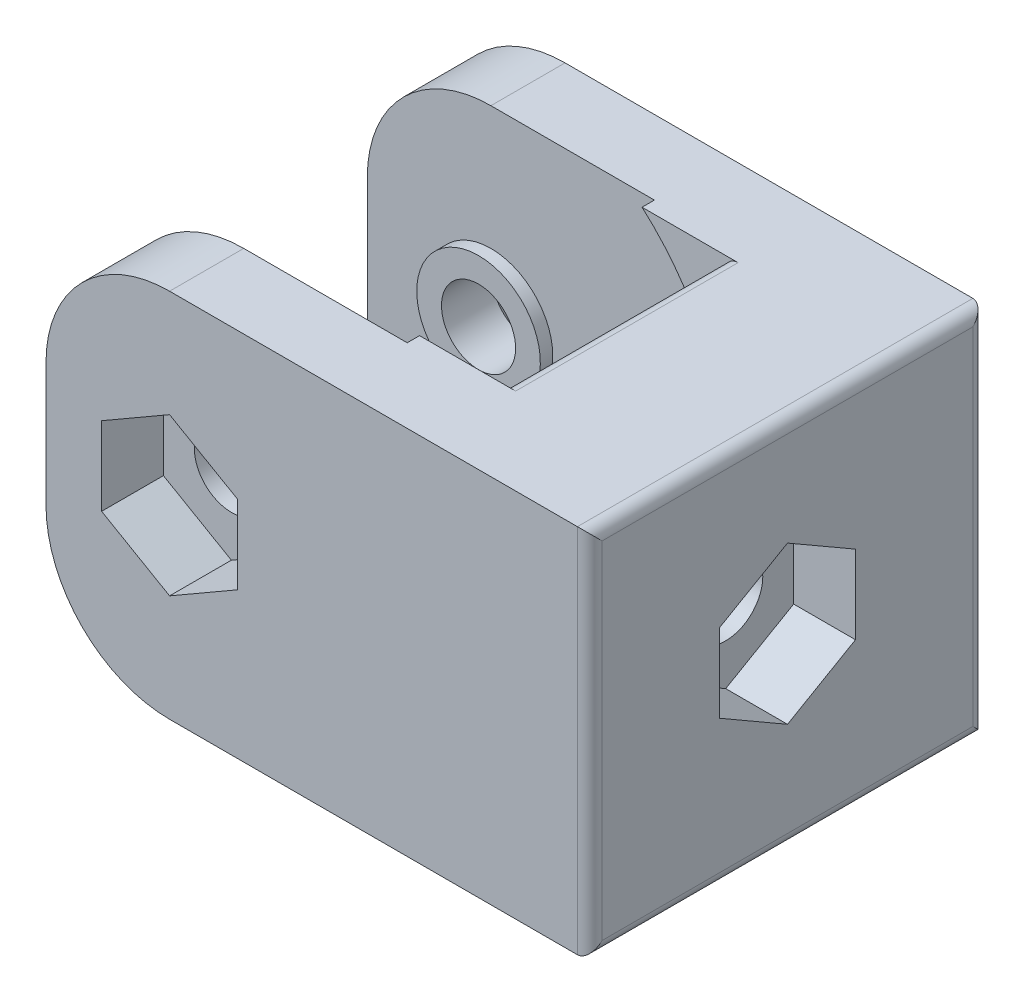
from build123d import *

# Parameters (mm, degrees)
SKETCH1_W                = 22
SKETCH1_H                = 15
BOSS_EXTRUDE1_DEPTH      = 16
SKETCH2_R                = 1.5
CUT_EXTRUDE1_DEPTH       = 32.064449134
CUT_EXTRUDE2_DEPTH       = 5
CUT_EXTRUDE2_DEPTH_BACK  = 5
SKETCH3_R                = 10
SKETCH3_R_2              = 2.5
SKETCH4_W                = 9
SKETCH4_H                = 15
CUT_EXTRUDE3_DEPTH       = 15
SKETCH10_R               = 1.5
CUT_EXTRUDE5_DEPTH       = 32.064449134
SKETCH11_R               = 3.15
CUT_EXTRUDE6_DEPTH       = 1.45
CUT_EXTRUDE6_DRAFT       = -45
CUT_EXTRUDE8_DEPTH       = 2.5
FILLET1_R                = 5
FILLET2_R                = 0.5
SKETCH9_R                = 3.15
CUT_EXTRUDE10_DEPTH      = 1.45
CUT_EXTRUDE10_DRAFT      = -45
CUT_EXTRUDE12_DEPTH      = 1
CUT_EXTRUDE12_DEPTH_BACK = 2.5


with BuildPart() as part:
    # Sketch1 → Boss-Extrude1 (new body)
    with BuildSketch(Plane.XY):
        with Locations((-11, 7.5)):
            Rectangle(SKETCH1_W, SKETCH1_H)
    extrude(amount=BOSS_EXTRUDE1_DEPTH)

    # Sketch2 → Cut-Extrude1 (cut, through all)
    with BuildSketch(Plane.XY.offset(16)):
        with Locations((-17, 7.5)):
            Circle(SKETCH2_R)
    extrude(amount=-CUT_EXTRUDE1_DEPTH, mode=Mode.SUBTRACT)

    # Sketch3 → Cut-Extrude2 (cut, two sides: drawn at the far end of the back side and taken through both)
    with BuildSketch(Plane.XY.offset(8).offset(-CUT_EXTRUDE2_DEPTH_BACK)):
        with Locations((-17, 7.5)):
            Circle(SKETCH3_R)
        with Locations((-17, 7.5)):
            Circle(SKETCH3_R_2, mode=Mode.SUBTRACT)
    extrude(amount=CUT_EXTRUDE2_DEPTH + CUT_EXTRUDE2_DEPTH_BACK, mode=Mode.SUBTRACT)

    # Sketch4 → Cut-Extrude3 (cut)
    with BuildSketch(Plane.ZY.offset(22)):
        with Locations((8, 7.5)):
            Rectangle(SKETCH4_W, SKETCH4_H)
    extrude(amount=-CUT_EXTRUDE3_DEPTH, mode=Mode.SUBTRACT)

    # Sketch10 → Cut-Extrude5 (cut, through all)
    with BuildSketch(Plane(origin=(0, 0, 0), x_dir=(0, 0, -1), z_dir=(1, 0, 0))):
        with Locations((-8, 7.5)):
            Circle(SKETCH10_R)
    extrude(amount=-CUT_EXTRUDE5_DEPTH, mode=Mode.SUBTRACT)


with BuildPart() as cut_extrude6_tool:
    # Sketch11 → Cut-Extrude6 (with draft: the straight prism first)
    with BuildSketch(Plane.ZY.offset(7)):
        with Locations((8, 7.5)):
            Circle(SKETCH11_R)
    extrude(amount=-CUT_EXTRUDE6_DEPTH)
    # Cut-Extrude6: the draft: its side faces are tilted about the plane it starts from
    cut_extrude6_sides = [cut_extrude6_tool.faces().sort_by_distance(p)[0] for p in [
        (-6.275, 7.5, 4.85),
    ]]
    draft(cut_extrude6_sides, Plane.ZY.offset(7), CUT_EXTRUDE6_DRAFT)


with BuildPart() as part_1:
    add(part.part)

    # Cut-Extrude6: cut by cut_extrude6_tool
    add(cut_extrude6_tool.part, mode=Mode.SUBTRACT)

    # Sketch13 → Cut-Extrude8 (cut)
    with BuildSketch(Plane(origin=(0, 0, 0), x_dir=(0, 0, -1), z_dir=(1, 0, 0))):
        Polygon((-5.250369343, 9.0875), (-8, 10.675), (-10.749630657, 9.0875), (-10.749630657, 5.9125), (-8, 4.325), (-5.250369343, 5.9125), align=None)
    extrude(amount=-CUT_EXTRUDE8_DEPTH, mode=Mode.SUBTRACT)

    # Fillet1
    fillet1_edges = [part_1.edges().sort_by_distance(p)[0] for p in [
        (-22, 0, 1.5),
        (-22, 15, 1.5),
        (-22, 0, 14.5),
        (-22, 15, 14.5),
    ]]
    fillet(fillet1_edges, radius=FILLET1_R)

    # Fillet2
    fillet2_edges = [part_1.edges().sort_by_distance(p)[0] for p in [
        (0, 7.5, 16),
        (-7, 15, 8),
        (-7, 0, 8),
        (0, 7.5, 0),
        (0, 0, 8),
        (0, 15, 8),
    ]]
    fillet(fillet2_edges, radius=FILLET2_R)


with BuildPart() as cut_extrude10_tool:
    # Sketch9 → Cut-Extrude10 (with draft: the straight prism first)
    with BuildSketch(Plane(origin=(0, 0, 0), x_dir=(-1, 0, 0), z_dir=(0, 0, -1))):
        with Locations((17, 7.5)):
            Circle(SKETCH9_R)
    extrude(amount=-CUT_EXTRUDE10_DEPTH)
    # Cut-Extrude10: the draft: its side faces are tilted about the plane it starts from
    cut_extrude10_sides = [cut_extrude10_tool.faces().sort_by_distance(p)[0] for p in [
        (-13.85, 7.5, 0.725),
    ]]
    draft(cut_extrude10_sides, Plane(origin=(0, 0, 0), x_dir=(-1, 0, 0), z_dir=(0, 0, -1)), CUT_EXTRUDE10_DRAFT)


with BuildPart() as part_2:
    add(part_1.part)

    # Cut-Extrude10: cut by cut_extrude10_tool
    add(cut_extrude10_tool.part, mode=Mode.SUBTRACT)

    # Sketch12 → Cut-Extrude12 (cut, two sides: drawn at the far end of the back side and taken through both)
    with BuildSketch(Plane.XY.offset(16).offset(-CUT_EXTRUDE12_DEPTH_BACK)):
        Polygon((-14.250369343, 9.0875), (-17, 10.675), (-19.749630657, 9.0875), (-19.749630657, 5.9125), (-17, 4.325), (-14.250369343, 5.9125), align=None)
    extrude(amount=CUT_EXTRUDE12_DEPTH + CUT_EXTRUDE12_DEPTH_BACK, mode=Mode.SUBTRACT)


solid = part_2.part
